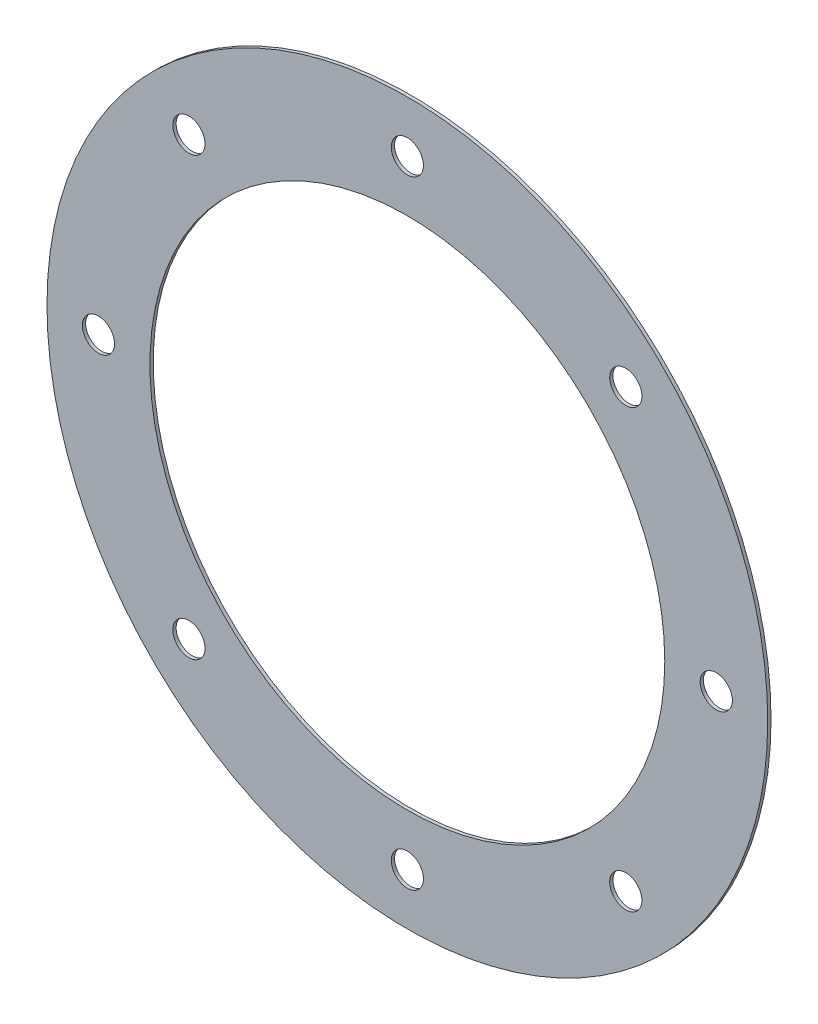
from build123d import *

# Parameters (mm, degrees)
SKETCH1_R           = 28
SKETCH1_R_2         = 20
BOSS_EXTRUDE1_DEPTH = 0.254
CIRPATTERN1_COUNT   = 8


with BuildPart() as part:
    # Sketch1 → Boss-Extrude1 (new body)
    with BuildSketch(Plane.XY):
        Circle(SKETCH1_R)
        Circle(SKETCH1_R_2, mode=Mode.SUBTRACT)
    extrude(amount=BOSS_EXTRUDE1_DEPTH)

    # Sketch2 → Ø2.5 (2.5) Diameter Hole1 (revolve, cut)
    with BuildSketch(Plane(origin=(0, 24, 0.254), x_dir=(0, -1, 0), z_dir=(1, 0, 0))):
        Polygon((0, 0), (0, 2.251075774), (1.25, 1.5), (1.25, 0), align=None)
    f_2_5_2_5_diameter_hole1 = revolve(axis=Axis((0, 24, 6.604), (0, 0, -1)), mode=Mode.SUBTRACT)

    # CirPattern1: Ø2.5 (2.5) Diameter Hole1 ×8 about axis
    cirpattern1_axis = Axis((0, 0, -0.0127), (0, 0, -1))
    for i in range(1, CIRPATTERN1_COUNT):
        add(f_2_5_2_5_diameter_hole1.rotate(cirpattern1_axis, i * 360 / CIRPATTERN1_COUNT), mode=Mode.SUBTRACT)


solid = part.part
